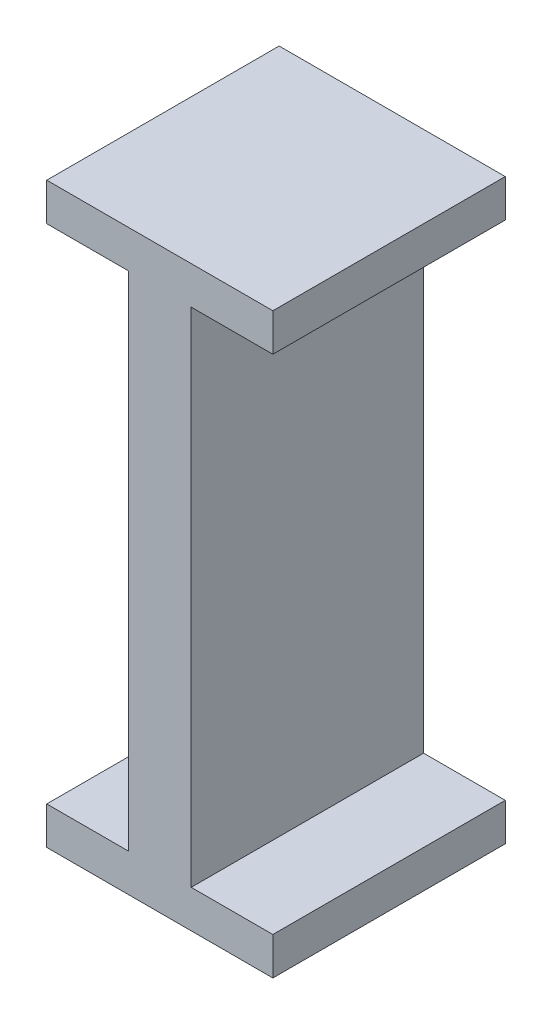
from build123d import *

# Parameters (mm, degrees)
SKETCH_1_W      = 36
SKETCH_1_H      = 37
EXTRUDE_1_DEPTH = 6
SKETCH_2_W      = 10
SKETCH_2_H      = 37
EXTRUDE_2_DEPTH = 80
SKETCH_3_W      = 36
SKETCH_3_H      = 37
EXTRUDE_3_DEPTH = 6


with BuildPart() as part:
    # 草图1 → 凸台-拉伸1 (new body)
    with BuildSketch(Plane(origin=(0, 0, 0), x_dir=(1, 0, 0), z_dir=(0, 1, 0))):
        Rectangle(SKETCH_1_W, SKETCH_1_H)
    extrude(amount=EXTRUDE_1_DEPTH)

    # 草图2 → 凸台-拉伸2 (add)
    with BuildSketch(Plane(origin=(0, 6, 0), x_dir=(1, 0, 0), z_dir=(0, 1, 0))):
        Rectangle(SKETCH_2_W, SKETCH_2_H)
    extrude(amount=EXTRUDE_2_DEPTH)

    # 草图3 → 凸台-拉伸3 (add)
    with BuildSketch(Plane(origin=(0, 86, 0), x_dir=(1, 0, 0), z_dir=(0, 1, 0))):
        Rectangle(SKETCH_3_W, SKETCH_3_H)
    extrude(amount=EXTRUDE_3_DEPTH)


solid = part.part
